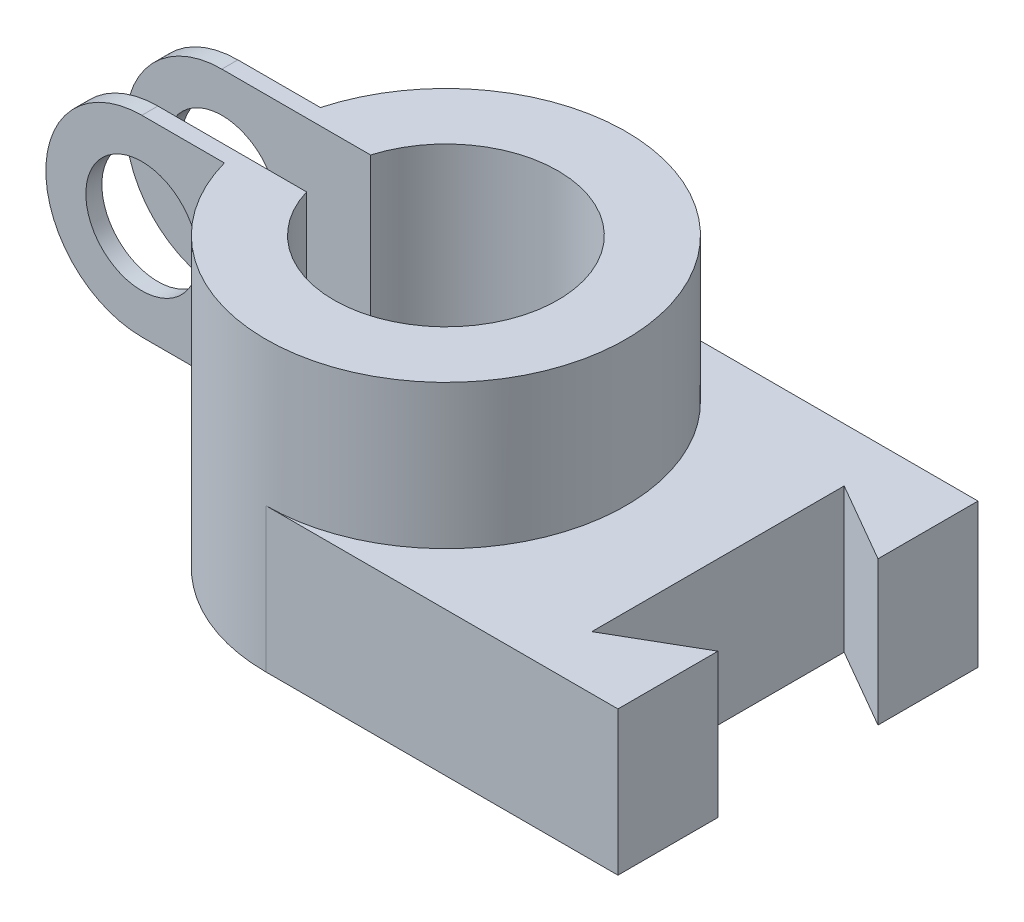
from build123d import *

# Parameters (mm, degrees)
EXTRUDE_1_DEPTH     = 36
EXTRUDE_2_DEPTH     = 18
EXTRUDE_START       = 4
SKETCH_3_R          = 7
EXTRUDE_3_DEPTH     = 2
EXTRUDE_START_2     = -6
SKETCH_3_2_R        = 7
EXTRUDE_4_DEPTH     = 2
CUT_EXTRUDE_1_DEPTH = 53.595151868


with BuildPart() as part:
    # 草图1 → 凸台-拉伸1 (new body)
    with BuildSketch(Plane(origin=(0, 0, 0), x_dir=(1, 0, 0), z_dir=(0, 1, 0))):
        with BuildLine():
            ThreePointArc((0, 22.5), (-14.426538046, 17.26629665), (-22.141589825, 4))
            Line((-22.141589825, 4), (-13.416407865, 4))
            ThreePointArc((-13.416407865, 4), (14, 0), (-13.416407865, -4))
            Line((-13.416407865, -4), (-22.141589825, -4))
            ThreePointArc((-22.141589825, -4), (-14.426538046, -17.26629665), (0, -22.5))
            ThreePointArc((0, -22.5), (22.5, 0), (0, 22.5))
        make_face()
    extrude(amount=EXTRUDE_1_DEPTH)

    # 草图1<3> → 凸台-拉伸2 (add)
    with BuildSketch(Plane(origin=(0, 0, 0), x_dir=(1, 0, 0), z_dir=(0, 1, 0))):
        with BuildLine():
            Line((44, 22.5), (0, 22.5))
            ThreePointArc((0, 22.5), (22.5, 0), (0, -22.5))
            Line((0, -22.5), (44, -22.5))
            Line((44, -22.5), (44, 22.5))
        make_face()
    extrude(amount=EXTRUDE_2_DEPTH)

    # 草图3 → 凸台-拉伸3 (add)
    with BuildSketch(Plane.XY.offset(EXTRUDE_START)):
        with BuildLine():
            Line((-32, 36), (-21.239733593, 36))
            Line((-21.239733593, 36), (-21.239733593, 12))
            Line((-21.239733593, 12), (-32, 12))
            ThreePointArc((-32, 12), (-44, 24), (-32, 36))
        make_face()
        with Locations((-32, 24)):
            Circle(SKETCH_3_R, mode=Mode.SUBTRACT)
    extrude(amount=EXTRUDE_3_DEPTH)

    # 草图3<2> → 凸台-拉伸4 (add)
    with BuildSketch(Plane.XY.offset(EXTRUDE_START_2)):
        with BuildLine():
            Line((-32, 36), (-21.239733593, 36))
            Line((-21.239733593, 36), (-21.239733593, 12))
            Line((-21.239733593, 12), (-32, 12))
            ThreePointArc((-32, 12), (-44, 24), (-32, 36))
        make_face()
        with Locations((-32, 24)):
            Circle(SKETCH_3_2_R, mode=Mode.SUBTRACT)
    extrude(amount=EXTRUDE_4_DEPTH)

    # 草图4 → 切除-拉伸1 (cut, through all)
    with BuildSketch(Plane(origin=(0, 18, 0), x_dir=(1, 0, 0), z_dir=(0, 1, 0))):
        Polygon((44, 10), (34, 15.773502692), (34, -15.773502692), (44, -10), align=None)
    extrude(amount=-CUT_EXTRUDE_1_DEPTH, mode=Mode.SUBTRACT)


solid = part.part
